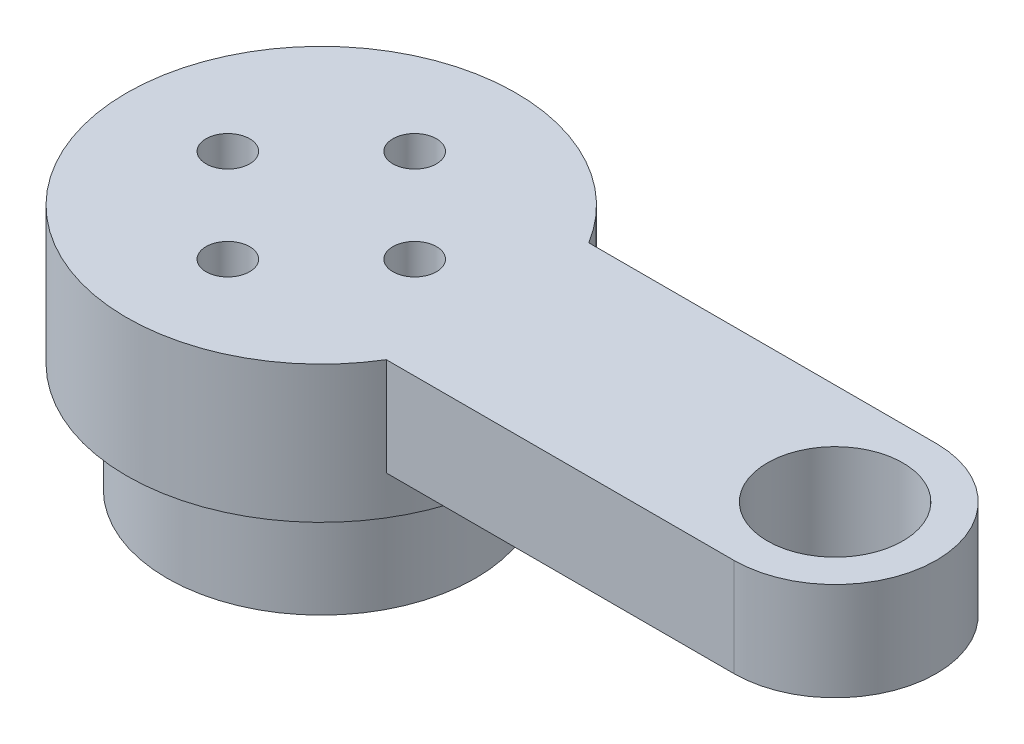
from build123d import *

# Parameters (mm, degrees)
SKETCH_1_R      = 9.9
SKETCH_1_R_2    = 1.4
EXTRUDE_1_DEPTH = 7
SKETCH_2_R      = 12.5
SKETCH_2_R_2    = 1.4
EXTRUDE_2_DEPTH = 2.5
SKETCH_3_R      = 1.4
SKETCH_3_R_2    = 4.35
EXTRUDE_3_DEPTH = 6.3


with BuildPart() as part:
    # 草图1 → 凸台-拉伸1 (new body)
    with BuildSketch(Plane(origin=(0, 0, 0), x_dir=(1, 0, 0), z_dir=(0, 1, 0))):
        with Locations(Location((0, 0, 0), (0, 0, 270))):
            Circle(SKETCH_1_R)
        with Locations(Location((6, 0, 0), (0, 0, 270))):
            Circle(SKETCH_1_R_2, mode=Mode.SUBTRACT)
        with Locations(Location((0, -6, 0), (0, 0, 270))):
            Circle(SKETCH_1_R_2, mode=Mode.SUBTRACT)
        with Locations(Location((-6, 0, 0), (0, 0, 270))):
            Circle(SKETCH_1_R_2, mode=Mode.SUBTRACT)
        with Locations(Location((0, 6, 0), (0, 0, 270))):
            Circle(SKETCH_1_R_2, mode=Mode.SUBTRACT)
    extrude(amount=EXTRUDE_1_DEPTH)

    # 草图2 → 凸台-拉伸2 (add)
    with BuildSketch(Plane(origin=(0, 7, 0), x_dir=(1, 0, 0), z_dir=(0, 1, 0))):
        with Locations(Location((0, 0, 0), (0, 0, 270))):
            Circle(SKETCH_2_R)
        with Locations(Location((-6, 0, 0), (0, 0, 270))):
            Circle(SKETCH_2_R_2, mode=Mode.SUBTRACT)
        with Locations(Location((0, -6, 0), (0, 0, 270))):
            Circle(SKETCH_2_R_2, mode=Mode.SUBTRACT)
        with Locations(Location((6, 0, 0), (0, 0, 270))):
            Circle(SKETCH_2_R_2, mode=Mode.SUBTRACT)
        with Locations(Location((0, 6, 0), (0, 0, 270))):
            Circle(SKETCH_2_R_2, mode=Mode.SUBTRACT)
    extrude(amount=EXTRUDE_2_DEPTH)

    # 草图3 → 凸台-拉伸3 (add)
    with BuildSketch(Plane(origin=(0, 9.5, 0), x_dir=(1, 0, 0), z_dir=(0, 1, 0))):
        with BuildLine():
            Line((33, 6.5), (10.677078252, 6.5))
            ThreePointArc((10.677078252, 6.5), (-12.5, 0), (10.677078252, -6.5))
            Line((10.677078252, -6.5), (33, -6.5))
            ThreePointArc((33, -6.5), (39.5, 0), (33, 6.5))
        make_face()
        with Locations(Location((6, 0, 0), (0, 0, 270))):
            Circle(SKETCH_3_R, mode=Mode.SUBTRACT)
        with Locations(Location((-6, 0, 0), (0, 0, 270))):
            Circle(SKETCH_3_R, mode=Mode.SUBTRACT)
        with Locations(Location((33, 0, 0), (0, 0, 270))):
            Circle(SKETCH_3_R_2, mode=Mode.SUBTRACT)
        with Locations(Location((0, 6, 0), (0, 0, 270))):
            Circle(SKETCH_3_R, mode=Mode.SUBTRACT)
        with Locations(Location((0, -6, 0), (0, 0, 270))):
            Circle(SKETCH_3_R, mode=Mode.SUBTRACT)
    extrude(amount=EXTRUDE_3_DEPTH)


solid = part.part
